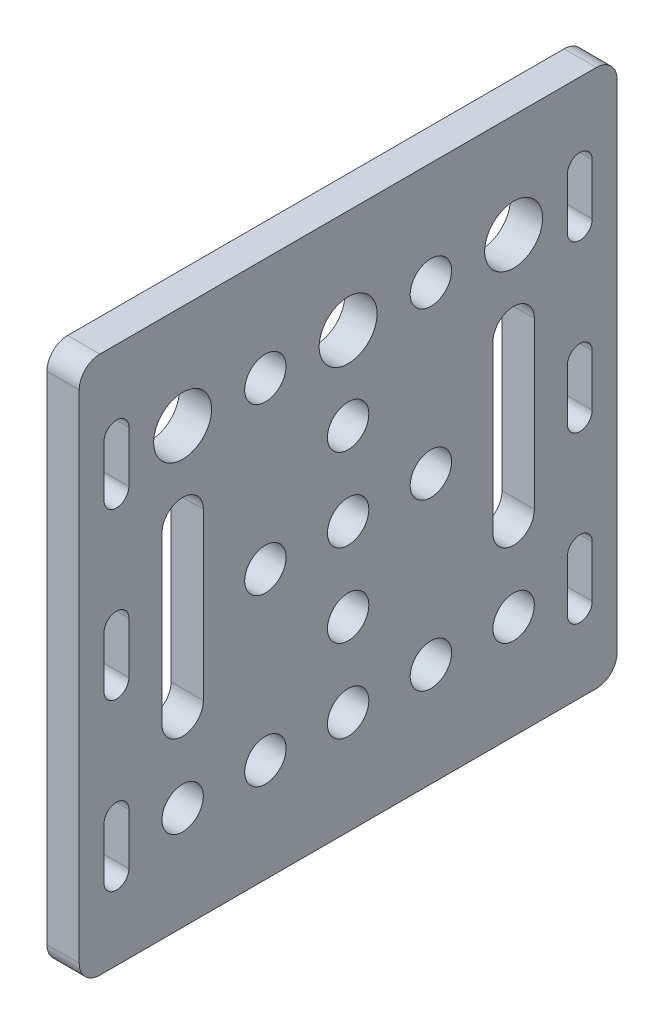
from build123d import *

# Parameters (mm, degrees)
SKETCH1_R           = 2.5
SKETCH1_R_2         = 3.5
BOSS_EXTRUDE1_DEPTH = 3.9


with BuildPart() as part:
    # Sketch1 → Boss-Extrude1 (new body)
    with BuildSketch(Plane(origin=(0, 0, 0), x_dir=(0, 0, -1), z_dir=(1, 0, 0))):
        with BuildLine():
            Line((30, 32.5), (-30, 32.5))
            ThreePointArc((-30, 32.5), (-31.767766953, 31.767766953), (-32.5, 30))
            Line((-32.5, 30), (-32.5, -30))
            ThreePointArc((-32.5, -30), (-31.767766953, -31.767766953), (-30, -32.5))
            Line((-30, -32.5), (30, -32.5))
            ThreePointArc((30, -32.5), (31.767766953, -31.767766953), (32.5, -30))
            Line((32.5, -30), (32.5, 30))
            ThreePointArc((32.5, 30), (31.767766953, 31.767766953), (30, 32.5))
        make_face()
        with Locations((0, -20)):
            Circle(SKETCH1_R, mode=Mode.SUBTRACT)
        with Locations((10, -20)):
            Circle(SKETCH1_R, mode=Mode.SUBTRACT)
        with Locations((-10, -20)):
            Circle(SKETCH1_R, mode=Mode.SUBTRACT)
        with Locations((10, 0)):
            Circle(SKETCH1_R, mode=Mode.SUBTRACT)
        with Locations((0, -10)):
            Circle(SKETCH1_R, mode=Mode.SUBTRACT)
        with Locations((-10, 0)):
            Circle(SKETCH1_R, mode=Mode.SUBTRACT)
        Circle(SKETCH1_R, mode=Mode.SUBTRACT)
        with Locations((0, 10)):
            Circle(SKETCH1_R, mode=Mode.SUBTRACT)
        with Locations((20, -20)):
            Circle(SKETCH1_R, mode=Mode.SUBTRACT)
        with Locations((-20, -20)):
            Circle(SKETCH1_R, mode=Mode.SUBTRACT)
        with Locations((10, 20)):
            Circle(SKETCH1_R, mode=Mode.SUBTRACT)
        with Locations((0, 20)):
            Circle(SKETCH1_R_2, mode=Mode.SUBTRACT)
        with Locations((-10, 20)):
            Circle(SKETCH1_R, mode=Mode.SUBTRACT)
        with Locations((20, 20)):
            Circle(SKETCH1_R_2, mode=Mode.SUBTRACT)
        with Locations((-20, 20)):
            Circle(SKETCH1_R_2, mode=Mode.SUBTRACT)
        with BuildLine():
            Line((26.5, 16.9), (26.5, 23.1))
            ThreePointArc((26.5, 23.1), (28, 24.6), (29.5, 23.1))
            Line((29.5, 23.1), (29.5, 16.9))
            ThreePointArc((29.5, 16.9), (28, 15.4), (26.5, 16.9))
        make_face(mode=Mode.SUBTRACT)
        with BuildLine():
            Line((26.5, -3.1), (26.5, 3.1))
            ThreePointArc((26.5, 3.1), (28, 4.6), (29.5, 3.1))
            Line((29.5, 3.1), (29.5, -3.1))
            ThreePointArc((29.5, -3.1), (28, -4.6), (26.5, -3.1))
        make_face(mode=Mode.SUBTRACT)
        with BuildLine():
            Line((26.5, -23.1), (26.5, -16.9))
            ThreePointArc((26.5, -16.9), (28, -15.4), (29.5, -16.9))
            Line((29.5, -16.9), (29.5, -23.1))
            ThreePointArc((29.5, -23.1), (28, -24.6), (26.5, -23.1))
        make_face(mode=Mode.SUBTRACT)
        with BuildLine():
            Line((-29.5, -23.1), (-29.5, -16.9))
            ThreePointArc((-29.5, -16.9), (-28, -15.4), (-26.5, -16.9))
            Line((-26.5, -16.9), (-26.5, -23.1))
            ThreePointArc((-26.5, -23.1), (-28, -24.6), (-29.5, -23.1))
        make_face(mode=Mode.SUBTRACT)
        with BuildLine():
            Line((17.5, -10), (17.5, 10))
            ThreePointArc((17.5, 10), (20, 12.5), (22.5, 10))
            Line((22.5, 10), (22.5, -10))
            ThreePointArc((22.5, -10), (20, -12.5), (17.5, -10))
        make_face(mode=Mode.SUBTRACT)
        with BuildLine():
            Line((-22.5, -10), (-22.5, 10))
            ThreePointArc((-22.5, 10), (-20, 12.5), (-17.5, 10))
            Line((-17.5, 10), (-17.5, -10))
            ThreePointArc((-17.5, -10), (-20, -12.5), (-22.5, -10))
        make_face(mode=Mode.SUBTRACT)
        with BuildLine():
            Line((-29.5, 16.9), (-29.5, 23.1))
            ThreePointArc((-29.5, 23.1), (-28, 24.6), (-26.5, 23.1))
            Line((-26.5, 23.1), (-26.5, 16.9))
            ThreePointArc((-26.5, 16.9), (-28, 15.4), (-29.5, 16.9))
        make_face(mode=Mode.SUBTRACT)
        with BuildLine():
            Line((-29.5, -3.1), (-29.5, 3.1))
            ThreePointArc((-29.5, 3.1), (-28, 4.6), (-26.5, 3.1))
            Line((-26.5, 3.1), (-26.5, -3.1))
            ThreePointArc((-26.5, -3.1), (-28, -4.6), (-29.5, -3.1))
        make_face(mode=Mode.SUBTRACT)
    extrude(amount=-BOSS_EXTRUDE1_DEPTH)


solid = part.part
